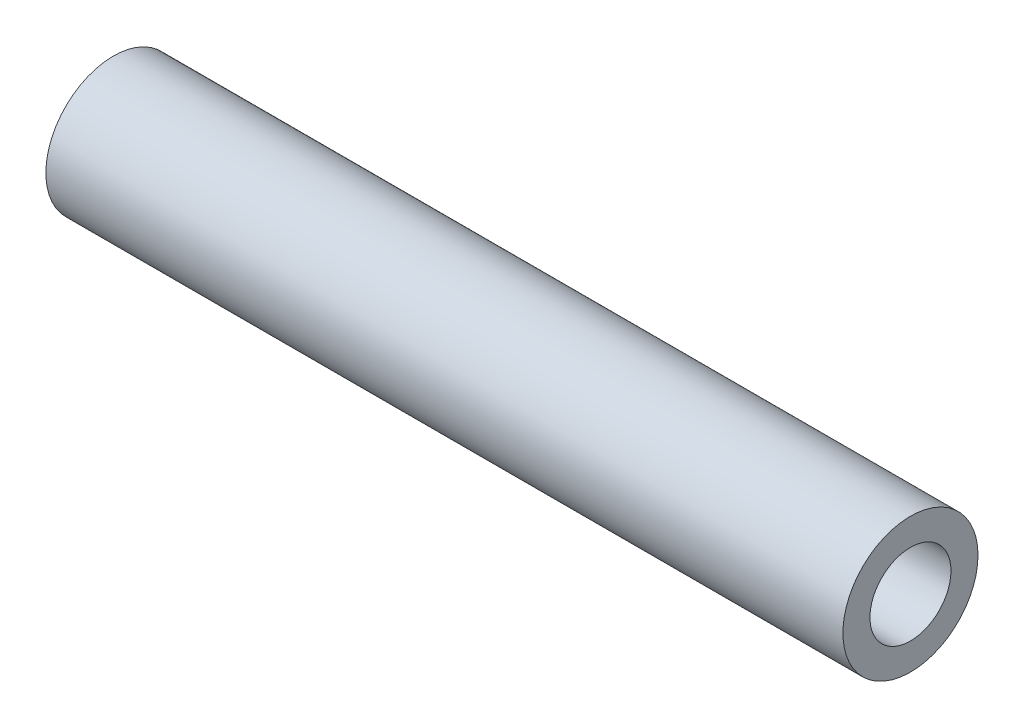
from build123d import *

# Parameters (mm, degrees)
SKETCH1_R           = 2.5
SKETCH1_R_2         = 1.5
BOSS_EXTRUDE1_DEPTH = 29.5


with BuildPart() as part:
    # Sketch1 → Boss-Extrude1 (new body)
    with BuildSketch(Plane(origin=(0, 0, 0), x_dir=(0, 0, -1), z_dir=(1, 0, 0))):
        Circle(SKETCH1_R)
        Circle(SKETCH1_R_2, mode=Mode.SUBTRACT)
    extrude(amount=BOSS_EXTRUDE1_DEPTH)


solid = part.part
